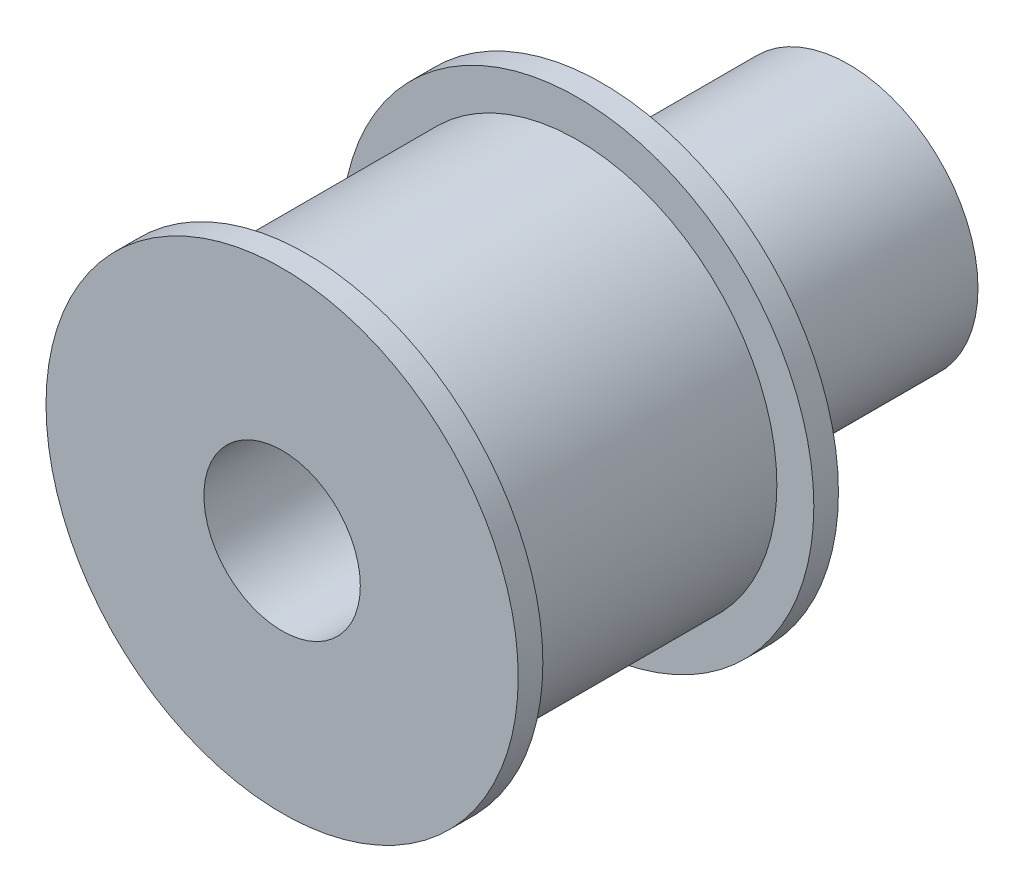
from build123d import *

# Parameters (mm, degrees)
SKETCH2_R          = 3.175
CUT_EXTRUDE1_DEPTH = 27.697325265
SKETCH3_R          = 1.5
CUT_EXTRUDE2_DEPTH = 27.697325265
SKETCH4_R          = 1.5
CUT_EXTRUDE3_DEPTH = 27.697325352


with BuildPart() as part:
    # Sketch1 → Revolve1 (revolve)
    with BuildSketch(Plane(origin=(0, 0, 0), x_dir=(1, 0, 0), z_dir=(0, 1, 0)), mode=Mode.PRIVATE) as revolve1_sk:
        Polygon((0, 23), (-5.25, 23), (-5.25, 13), (-9.585071109, 13), (-9.585071109, 12), (-8.085071109, 12), (-8.085071109, 1), (-9.585071109, 1), (-9.585071109, 0), (0, 0), align=None)
    revolve(revolve1_sk.sketch.rotate(Axis((0, 0, 0), (0, 0, -1)), 180), axis=Axis((0, 0, 0), (0, 0, -1)))

    # Sketch2 → Cut-Extrude1 (cut, through all)
    with BuildSketch(Plane.XY):
        Circle(SKETCH2_R)
    extrude(amount=-CUT_EXTRUDE1_DEPTH, mode=Mode.SUBTRACT)

    # Sketch3 → Cut-Extrude2 (cut, through all)
    with BuildSketch(Plane(origin=(0, 0, 0), x_dir=(1, 0, 0), z_dir=(0, 1, 0))):
        with Locations(Location((0, 18, 0), (0, 0, 270))):
            Circle(SKETCH3_R)
    extrude(amount=-CUT_EXTRUDE2_DEPTH, mode=Mode.SUBTRACT)

    # Sketch4 → Cut-Extrude3 (cut, through all)
    with BuildSketch(Plane(origin=(0, 0, 0), x_dir=(0, 0, -1), z_dir=(1, 0, 0))):
        with Locations((18, 0)):
            Circle(SKETCH4_R)
    extrude(amount=-CUT_EXTRUDE3_DEPTH, mode=Mode.SUBTRACT)


solid = part.part
